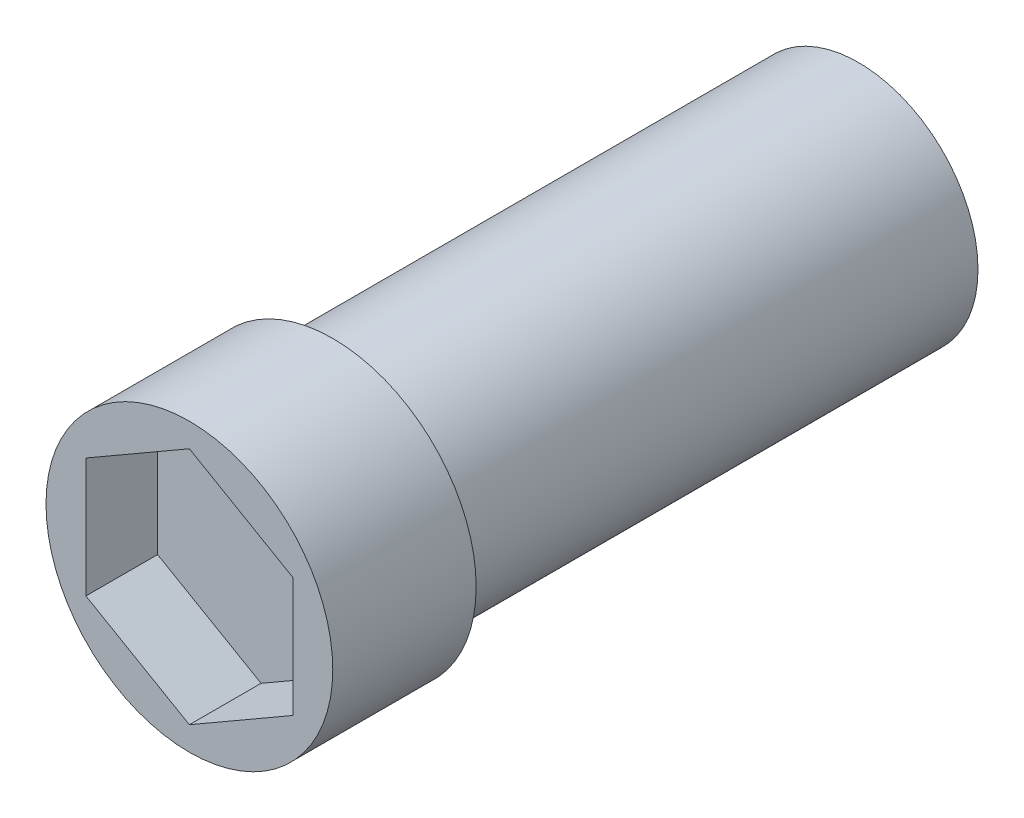
from build123d import *

# Parameters (mm, degrees)
SKETCH1_R           = 2.5
BOSS_EXTRUDE1_DEPTH = 11
SKETCH2_R           = 3
BOSS_EXTRUDE2_DEPTH = 3
CUT_EXTRUDE1_DEPTH  = 1.5


with BuildPart() as part:
    # Sketch1 → Boss-Extrude1 (new body)
    with BuildSketch(Plane.XY):
        Circle(SKETCH1_R)
    extrude(amount=BOSS_EXTRUDE1_DEPTH)

    # Sketch2 → Boss-Extrude2 (add)
    with BuildSketch(Plane.XY.offset(11)):
        Circle(SKETCH2_R)
    extrude(amount=BOSS_EXTRUDE2_DEPTH)

    # Sketch3 → Cut-Extrude1 (cut)
    with BuildSketch(Plane.XY.offset(14)):
        Polygon((0, 2.5), (-2.165063509, 1.25), (-2.165063509, -1.25), (0, -2.5), (2.165063509, -1.25), (2.165063509, 1.25), align=None)
    extrude(amount=-CUT_EXTRUDE1_DEPTH, mode=Mode.SUBTRACT)


solid = part.part
